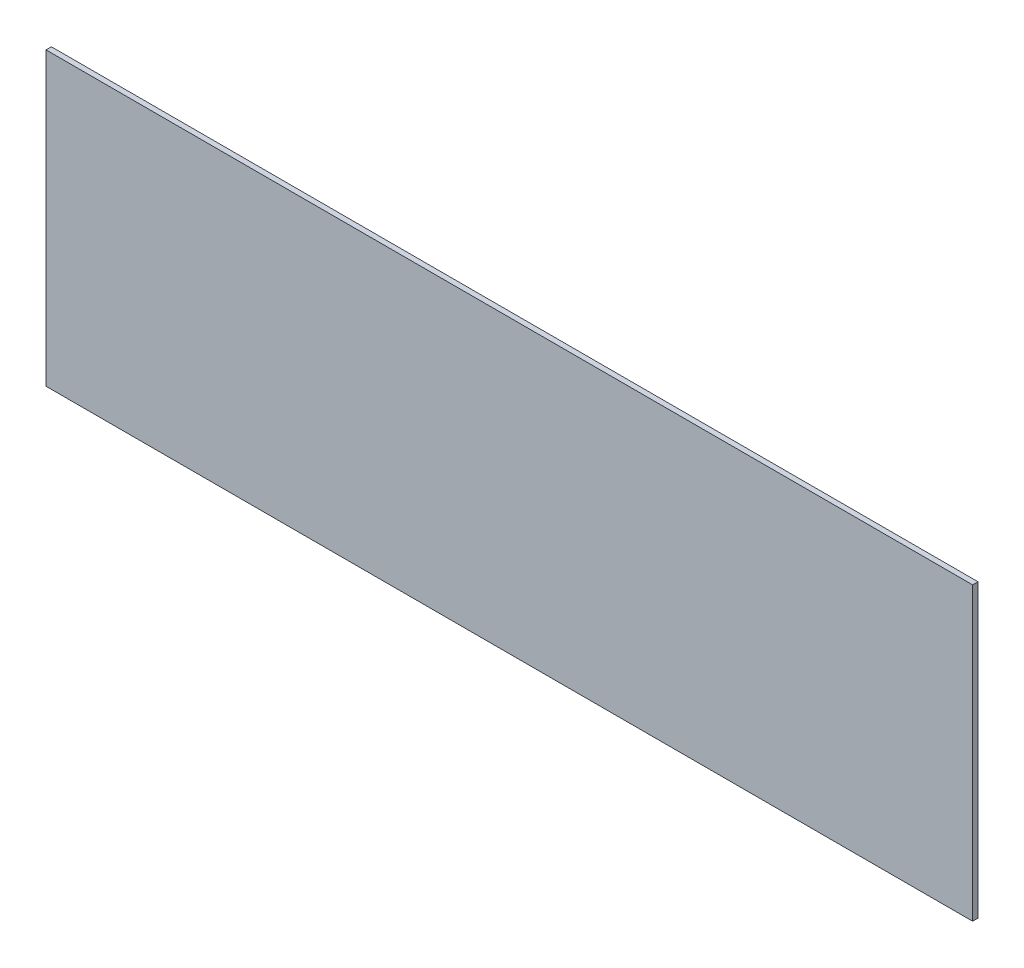
from build123d import *

# Parameters (mm, degrees)
SKETCH1_W           = 41.35
SKETCH1_H           = 13
BOSS_EXTRUDE1_DEPTH = 0.24


with BuildPart() as part:
    # Sketch1 → Boss-Extrude1 (new body)
    with BuildSketch(Plane.XY):
        with Locations((20.675, 6.5)):
            Rectangle(SKETCH1_W, SKETCH1_H)
    extrude(amount=BOSS_EXTRUDE1_DEPTH)


solid = part.part
